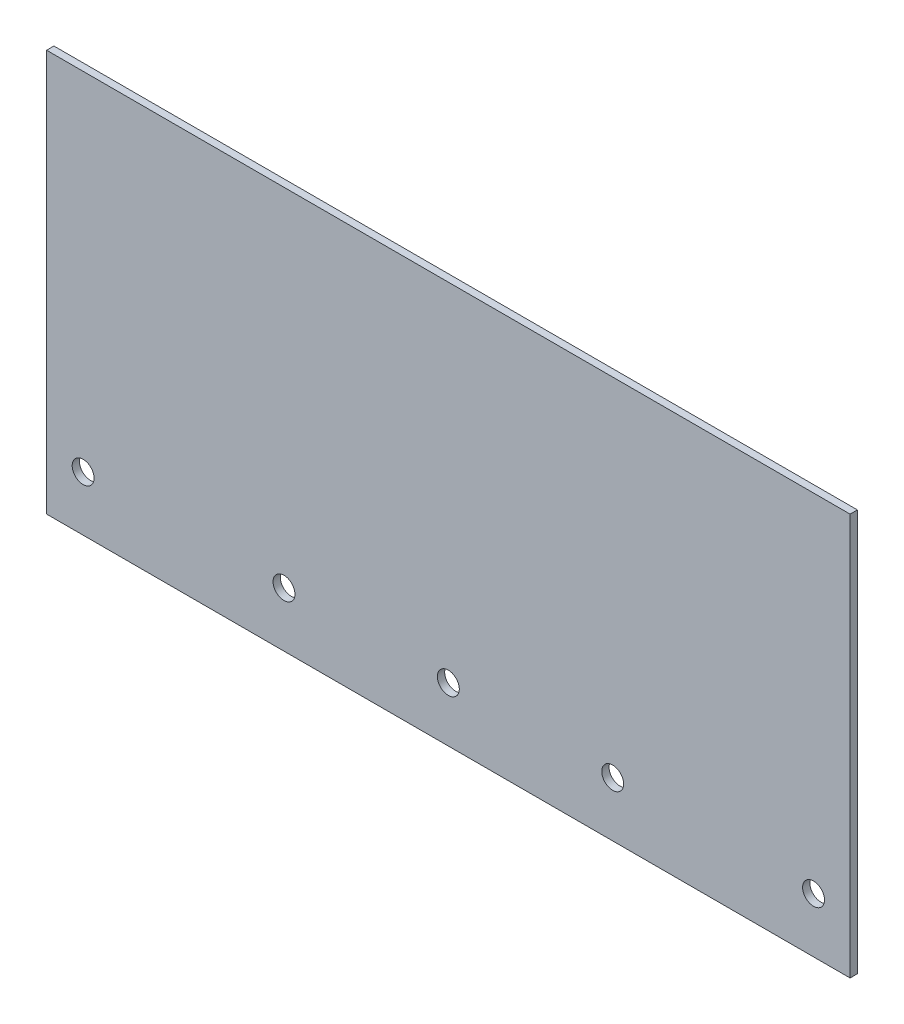
from build123d import *

# Parameters (mm, degrees)
SKETCH1_W           = 220
SKETCH1_H           = 110
BOSS_EXTRUDE1_DEPTH = 2
SKETCH2_R           = 3
CUT_EXTRUDE1_DEPTH  = 124


with BuildPart() as part:
    # Sketch1 → Boss-Extrude1 (new body)
    with BuildSketch(Plane.XY):
        Rectangle(SKETCH1_W, SKETCH1_H)
    extrude(amount=BOSS_EXTRUDE1_DEPTH)

    # Sketch2 → Cut-Extrude1 (cut, through all)
    with BuildSketch(Plane.XY.offset(2)):
        with Locations((-100, -40)):
            Circle(SKETCH2_R)
        with Locations((0, -40)):
            Circle(SKETCH2_R)
        with Locations((-45, -40)):
            Circle(SKETCH2_R)
        with Locations((45, -40)):
            Circle(SKETCH2_R)
        with Locations((100, -40)):
            Circle(SKETCH2_R)
    extrude(amount=-CUT_EXTRUDE1_DEPTH, mode=Mode.SUBTRACT)


solid = part.part
